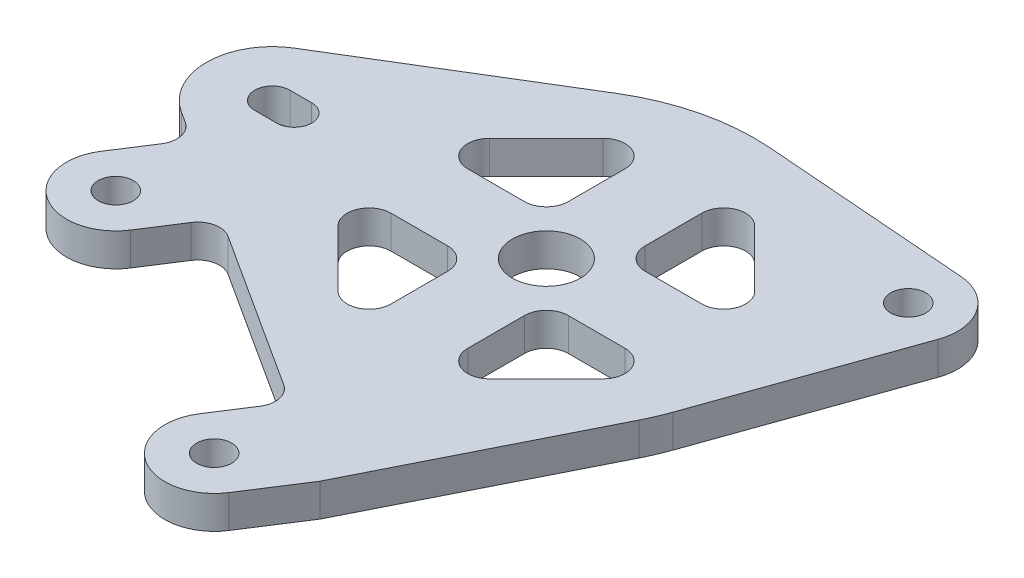
from build123d import *

# Parameters (mm, degrees)
SKETCH_1_R      = 3.1
SKETCH_1_R_2    = 1.6
EXTRUDE_1_DEPTH = 3
FILLET_1_R      = 2


with BuildPart() as part:
    # 草图1 → 凸台-拉伸1 (new body)
    with BuildSketch(Plane(origin=(0, 0, 0), x_dir=(1, 0, 0), z_dir=(0, 1, 0))):
        with BuildLine():
            Line((-82.094284463, 13.64505302), (-75.759172636, 31.494880978))
            ThreePointArc((-75.759172636, 31.494880978), (-76.227003727, 35.452447578), (-79.653832636, 37.486665594))
            Line((-79.653832636, 37.486665594), (-98.538404465, 38.943699177))
            ThreePointArc((-98.538404465, 38.943699177), (-104.422619767, 38.478106894), (-109.88, 36.229158943))
            Line((-109.88, 36.229158943), (-128.12, 25.124997561))
            ThreePointArc((-128.12, 25.124997561), (-130.999516523, 20.076167551), (-128.249103426, 14.955862123))
            Line((-128.249103426, 14.955862123), (-125.533999982, 13.206970217))
            Line((-125.533999982, 13.206970217), (-128.783103408, 8.16283234))
            ThreePointArc((-128.783103408, 8.16283234), (-127.43682757, 1.942901362), (-121.216896592, 3.289177201))
            Line((-121.216896592, 3.289177201), (-117.967793166, 8.333315078))
            Line((-117.967793166, 8.333315078), (-100.313310595, -3.038546913))
            Line((-100.313310595, -3.038546913), (-103.562414021, -8.08268479))
            ThreePointArc((-103.562414021, -8.08268479), (-102.216138182, -14.302615768), (-95.996207205, -12.956339929))
            Line((-95.996207205, -12.956339929), (-92.747103778, -7.912202052))
            Line((-92.747103778, -7.912202052), (-83.017679727, 11.479389802))
            ThreePointArc((-83.017679727, 11.479389802), (-82.522406202, 12.547905325), (-82.094284463, 13.64505302))
        make_face()
        Polygon((-96.5, 16.5), (-84.5, 16.5), (-96.5, 4.5), align=None, mode=Mode.SUBTRACT)
        Polygon((-103.5, 16.5), (-103.5, 4.5), (-115.5, 16.5), align=None, mode=Mode.SUBTRACT)
        Polygon((-103.5, 23.5), (-115.5, 23.5), (-103.5, 35.5), align=None, mode=Mode.SUBTRACT)
        Polygon((-96.5, 23.5), (-96.5, 35.5), (-84.5, 23.5), align=None, mode=Mode.SUBTRACT)
        with Locations(Location((-100, 20, 0), (0, 0, 270))):
            Circle(SKETCH_1_R, mode=Mode.SUBTRACT)
        with Locations(Location((-80, 33, 0), (0, 0, 270))):
            Circle(SKETCH_1_R_2, mode=Mode.SUBTRACT)
        with BuildLine():
            Line((-125, 21.6), (-123, 21.6))
            ThreePointArc((-123, 21.6), (-121.4, 20), (-123, 18.4))
            Line((-123, 18.4), (-125, 18.4))
            ThreePointArc((-125, 18.4), (-126.6, 20), (-125, 21.6))
        make_face(mode=Mode.SUBTRACT)
        with Locations(Location((-99.779310613, -10.51951236, 0), (0, 0, 270))):
            Circle(SKETCH_1_R_2, mode=Mode.SUBTRACT)
        with Locations(Location((-125, 5.726004771, 0), (0, 0, 270))):
            Circle(SKETCH_1_R_2, mode=Mode.SUBTRACT)
    extrude(amount=EXTRUDE_1_DEPTH)

    # 圆角1
    fillet_1_edges = [part.edges().sort_by_distance(p)[0] for p in [
        (-96.5, 1.5, -16.5),
        (-96.5, 1.5, -4.5),
        (-84.5, 1.5, -16.5),
        (-103.5, 1.5, -4.5),
        (-103.5, 1.5, -16.5),
        (-115.5, 1.5, -16.5),
        (-115.5, 1.5, -23.5),
        (-103.5, 1.5, -23.5),
        (-103.5, 1.5, -35.5),
        (-96.5, 1.5, -35.5),
        (-96.5, 1.5, -23.5),
        (-84.5, 1.5, -23.5),
        (-100.313310595, 1.5, 3.038546913),
        (-117.967793166, 1.5, -8.333315078),
        (-125.533999982, 1.5, -13.206970217),
    ]]
    fillet(fillet_1_edges, radius=FILLET_1_R)


solid = part.part
